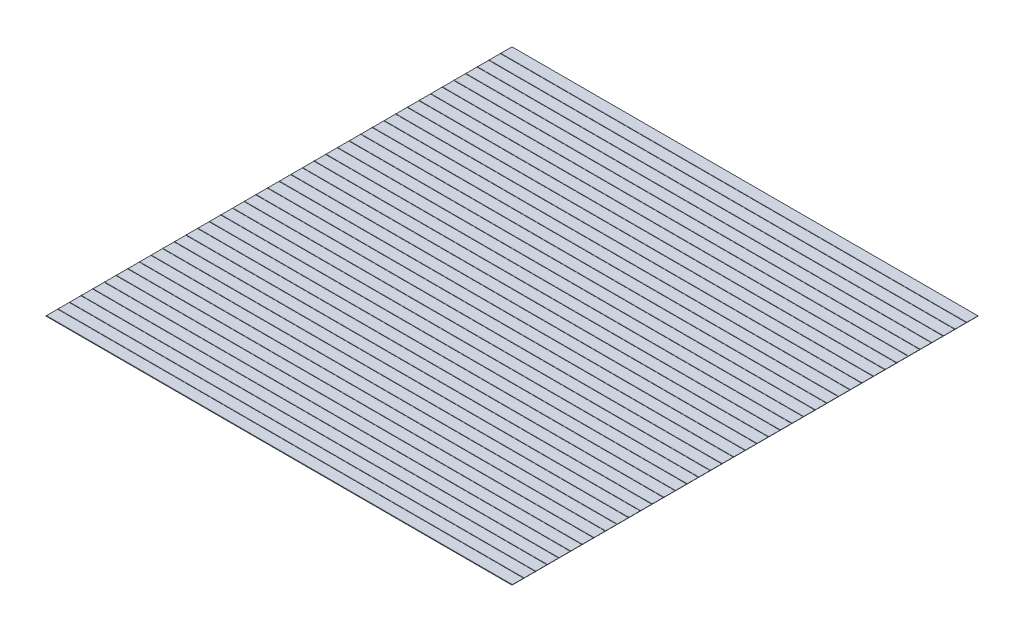
from build123d import *

# Parameters (mm, degrees)
EXTRUDE_1_DEPTH = 10000


with BuildPart() as part:
    # 草图1 → 凸台-拉伸1 (new body)
    with BuildSketch(Plane(origin=(0, 0, 0), x_dir=(0, 0, -1), z_dir=(1, 0, 0))):
        Polygon((0, 0), (10, 0), (10, -5), (250, -5), (250, 0), (260, 0), (260, -5), (500, -5), (500, 0), (510, 0), (510, -5), (750, -5), (750, 0), (760, 0), (760, -5), (1000, -5), (1000, 0), (1010, 0), (1010, -5), (1250, -5), (1250, 0), (1260, 0), (1260, -5), (1500, -5), (1500, 0), (1510, 0), (1510, -5), (1750, -5), (1750, 0), (1760, 0), (1760, -5), (2000, -5), (2000, 0), (2010, 0), (2010, -5), (2250, -5), (2250, 0), (2260, 0), (2260, -5), (2500, -5), (2500, 0), (2510, 0), (2510, -5), (2750, -5), (2750, 0), (2760, 0), (2760, -5), (3000, -5), (3000, 0), (3010, 0), (3010, -5), (3250, -5), (3250, 0), (3260, 0), (3260, -5), (3500, -5), (3500, 0), (3510, 0), (3510, -5), (3750, -5), (3750, 0), (3760, 0), (3760, -5), (4000, -5), (4000, 0), (4010, 0), (4010, -5), (4250, -5), (4250, 0), (4260, 0), (4260, -5), (4500, -5), (4500, 0), (4510, 0), (4510, -5), (4750, -5), (4750, 0), (4760, 0), (4760, -5), (5000, -5), (5000, 0), (5010, 0), (5010, -5), (5250, -5), (5250, 0), (5260, 0), (5260, -5), (5500, -5), (5500, 0), (5510, 0), (5510, -5), (5750, -5), (5750, 0), (5760, 0), (5760, -5), (6000, -5), (6000, 0), (6010, 0), (6010, -5), (6250, -5), (6250, 0), (6260, 0), (6260, -5), (6500, -5), (6500, 0), (6510, 0), (6510, -5), (6750, -5), (6750, 0), (6760, 0), (6760, -5), (7000, -5), (7000, 0), (7010, 0), (7010, -5), (7250, -5), (7250, 0), (7260, 0), (7260, -5), (7500, -5), (7500, 0), (7510, 0), (7510, -5), (7750, -5), (7750, 0), (7760, 0), (7760, -5), (8000, -5), (8000, 0), (8010, 0), (8010, -5), (8250, -5), (8250, 0), (8260, 0), (8260, -5), (8500, -5), (8500, 0), (8510, 0), (8510, -5), (8750, -5), (8750, 0), (8760, 0), (8760, -5), (9000, -5), (9000, 0), (9010, 0), (9010, -5), (9250, -5), (9250, 0), (9260, 0), (9260, -5), (9500, -5), (9500, 0), (9510, 0), (9510, -5), (9750, -5), (9750, 0), (9760, 0), (9760, -5), (10000, -5), (10000, -10), (0, -10), align=None)
    extrude(amount=EXTRUDE_1_DEPTH)


solid = part.part
